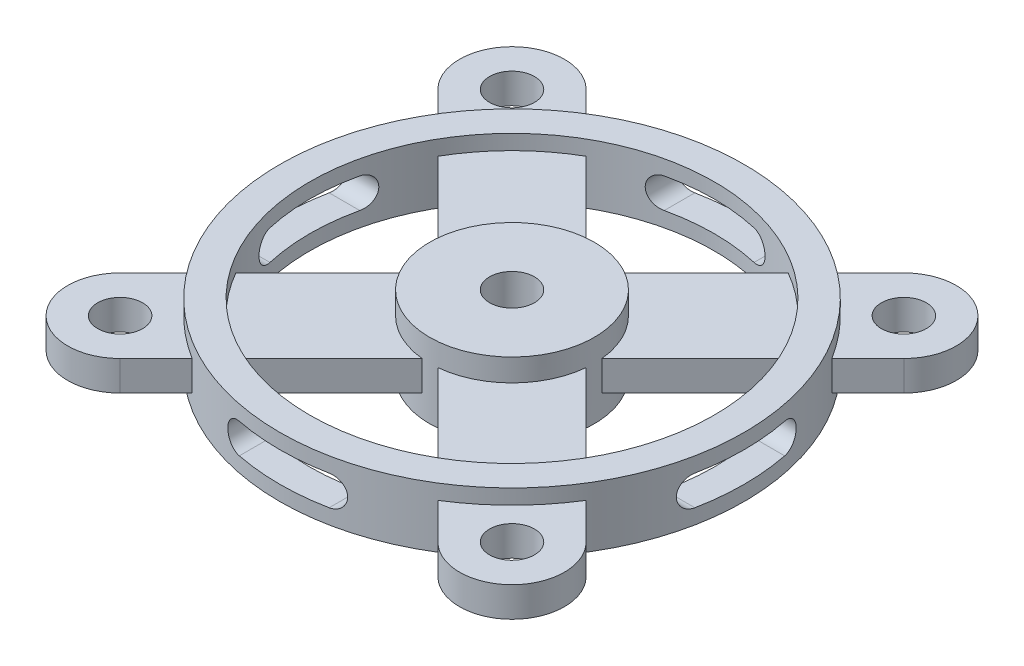
from build123d import *

# Parameters (mm, degrees)
SKETCH1_R                = 15.5
SKETCH1_R_2              = 13.5
BOSS_EXTRUDE1_DEPTH      = 4
CUT_EXTRUDE1_DEPTH       = 44
CUT_EXTRUDE1_DEPTH_BACK  = 44
CUT_EXTRUDE2_DEPTH       = 44
CUT_EXTRUDE2_DEPTH_BACK  = 44
BOSS_EXTRUDE2_DEPTH      = 1
BOSS_EXTRUDE2_DEPTH_BACK = 1
SKETCH5_R                = 1.5
CUT_EXTRUDE3_DEPTH       = 3
BOSS_EXTRUDE3_DEPTH      = 1.5
BOSS_EXTRUDE3_DEPTH_BACK = 3.5
SKETCH6_R                = 5.5
SKETCH6_R_2              = 1.5
SKETCH7_R                = 1.5
CUT_EXTRUDE4_DEPTH       = 11.5


with BuildPart() as part:
    # Sketch1 → Boss-Extrude1 (new body)
    with BuildSketch(Plane(origin=(0, 0, 0), x_dir=(1, 0, 0), z_dir=(0, 1, 0))):
        Circle(SKETCH1_R)
        Circle(SKETCH1_R_2, mode=Mode.SUBTRACT)
    extrude(amount=BOSS_EXTRUDE1_DEPTH)

    # Sketch2 → Cut-Extrude1 (cut, two sides: drawn at the far end of the back side and taken through both)
    with BuildSketch(Plane.XY.offset(-CUT_EXTRUDE1_DEPTH_BACK)):
        with BuildLine():
            Line((-3, 3), (3, 3))
            ThreePointArc((3, 3), (4, 2), (3, 1))
            Line((3, 1), (-3, 1))
            ThreePointArc((-3, 1), (-4, 2), (-3, 3))
        make_face()
    extrude(amount=CUT_EXTRUDE1_DEPTH + CUT_EXTRUDE1_DEPTH_BACK, mode=Mode.SUBTRACT)

    # Sketch3 → Cut-Extrude2 (cut, two sides: drawn at the far end of the back side and taken through both)
    with BuildSketch(Plane(origin=(0, 0, 0), x_dir=(0, 0, -1), z_dir=(1, 0, 0)).offset(-CUT_EXTRUDE2_DEPTH_BACK)):
        with BuildLine():
            Line((-3, 3), (3, 3))
            ThreePointArc((3, 3), (4, 2), (3, 1))
            Line((3, 1), (-3, 1))
            ThreePointArc((-3, 1), (-4, 2), (-3, 3))
        make_face()
    extrude(amount=CUT_EXTRUDE2_DEPTH + CUT_EXTRUDE2_DEPTH_BACK, mode=Mode.SUBTRACT)

    # Sketch4 → Boss-Extrude2 (add, two sides: drawn at the far end of the back side and taken through both)
    with BuildSketch(Plane(origin=(0, 2, 0), x_dir=(1, 0, 0), z_dir=(0, 1, 0)).offset(-BOSS_EXTRUDE2_DEPTH_BACK)):
        with BuildLine():
            Line((0, 4.949747468), (-10.606601718, 15.556349186))
            ThreePointArc((-10.606601718, 15.556349186), (-15.556349186, 15.556349186), (-15.556349186, 10.606601718))
            Line((-15.556349186, 10.606601718), (-4.949747468, 0))
            Line((-4.949747468, 0), (-15.556349186, -10.606601718))
            ThreePointArc((-15.556349186, -10.606601718), (-15.556349186, -15.556349186), (-10.606601718, -15.556349186))
            Line((-10.606601718, -15.556349186), (0, -4.949747468))
            Line((0, -4.949747468), (10.606601718, -15.556349186))
            ThreePointArc((10.606601718, -15.556349186), (15.556349186, -15.556349186), (15.556349186, -10.606601718))
            Line((15.556349186, -10.606601718), (4.949747468, 0))
            Line((4.949747468, 0), (15.556349186, 10.606601718))
            ThreePointArc((15.556349186, 10.606601718), (15.556349186, 15.556349186), (10.606601718, 15.556349186))
            Line((10.606601718, 15.556349186), (0, 4.949747468))
        make_face()
    extrude(amount=BOSS_EXTRUDE2_DEPTH + BOSS_EXTRUDE2_DEPTH_BACK)

    # Sketch5 → Cut-Extrude3 (cut)
    with BuildSketch(Plane(origin=(0, 3, 0), x_dir=(1, 0, 0), z_dir=(0, 1, 0))):
        Circle(SKETCH5_R)
    extrude(amount=-CUT_EXTRUDE3_DEPTH, mode=Mode.SUBTRACT)

    # Sketch6 → Boss-Extrude3 (add, two sides: drawn at the far end of the back side and taken through both)
    with BuildSketch(Plane(origin=(0, 3, 0), x_dir=(1, 0, 0), z_dir=(0, 1, 0)).offset(-BOSS_EXTRUDE3_DEPTH_BACK)):
        Circle(SKETCH6_R)
        Circle(SKETCH6_R_2, mode=Mode.SUBTRACT)
    extrude(amount=BOSS_EXTRUDE3_DEPTH + BOSS_EXTRUDE3_DEPTH_BACK)

    # Sketch7 → Cut-Extrude4 (cut)
    with BuildSketch(Plane(origin=(0, 3, 0), x_dir=(1, 0, 0), z_dir=(0, 1, 0))):
        with Locations((-13.081475452, 13.081475452)):
            Circle(SKETCH7_R)
        with Locations((13.081475452, 13.081475452)):
            Circle(SKETCH7_R)
        with Locations((13.081475452, -13.081475452)):
            Circle(SKETCH7_R)
        with Locations((-13.081475452, -13.081475452)):
            Circle(SKETCH7_R)
    extrude(amount=-CUT_EXTRUDE4_DEPTH, mode=Mode.SUBTRACT)


solid = part.part
